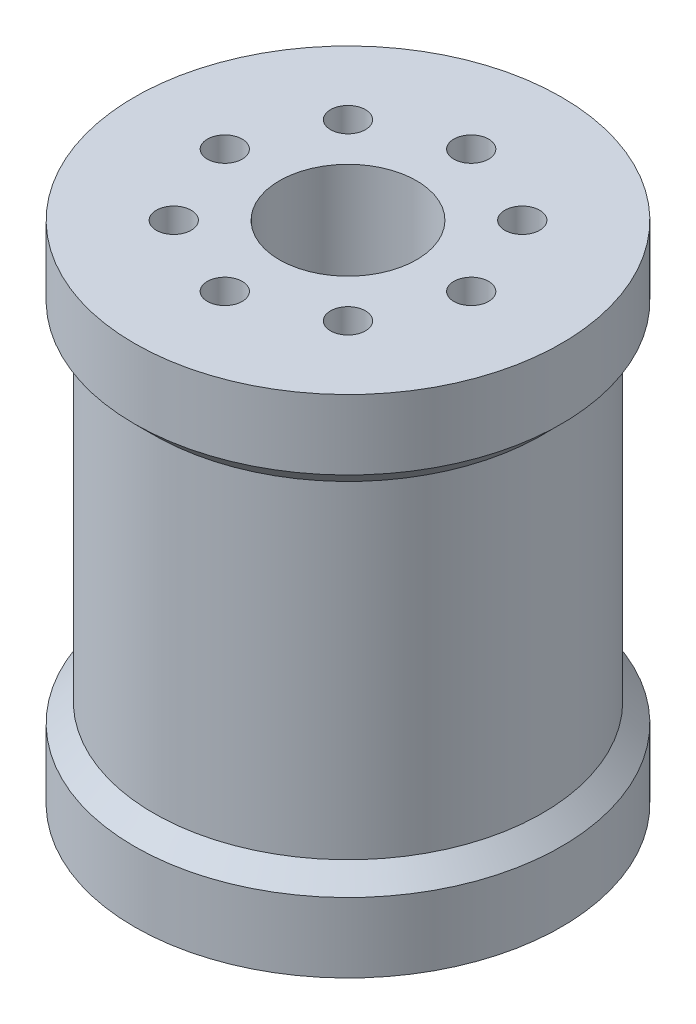
from build123d import *

# Parameters (mm, degrees)
SKETCH2_R          = 3.935
SKETCH2_R_2        = 1
CUT_EXTRUDE1_DEPTH = 45


with BuildPart() as part:
    # Sketch1 → Revolve1 (revolve)
    with BuildSketch(Plane.XY, mode=Mode.PRIVATE) as revolve1_sk:
        Polygon((-3, 0), (-3, 29), (-12.25, 29), (-12.25, 25), (-11.15, 23.9), (-11.15, 5.1), (-12.25, 4), (-12.25, 0), align=None)
    revolve(revolve1_sk.sketch.rotate(Axis((0, 0, 0), (0, 1, 0)), 270), axis=Axis((0, 0, 0), (0, 1, 0)))

    # Sketch2 → Cut-Extrude1 (cut)
    with BuildSketch(Plane(origin=(0, 29, 0), x_dir=(1, 0, 0), z_dir=(0, 1, 0))):
        with Locations(Location((0, 0, 0), (0, 0, 270))):
            Circle(SKETCH2_R)
        with Locations(Location((-5, 5, 0), (0, 0, 270))):
            Circle(SKETCH2_R_2)
        with Locations(Location((5, 5, 0), (0, 0, 270))):
            Circle(SKETCH2_R_2)
        with Locations(Location((5, -5, 0), (0, 0, 270))):
            Circle(SKETCH2_R_2)
        with Locations(Location((-5, -5, 0), (0, 0, 270))):
            Circle(SKETCH2_R_2)
        with Locations(Location((-7.071067812, 0, 0), (0, 0, 270))):
            Circle(SKETCH2_R_2)
        with Locations(Location((0, 7.071067812, 0), (0, 0, 270))):
            Circle(SKETCH2_R_2)
        with Locations(Location((7.071067812, 0, 0), (0, 0, 270))):
            Circle(SKETCH2_R_2)
        with Locations(Location((0, -7.071067812, 0), (0, 0, 270))):
            Circle(SKETCH2_R_2)
    extrude(amount=-CUT_EXTRUDE1_DEPTH, mode=Mode.SUBTRACT)


solid = part.part
